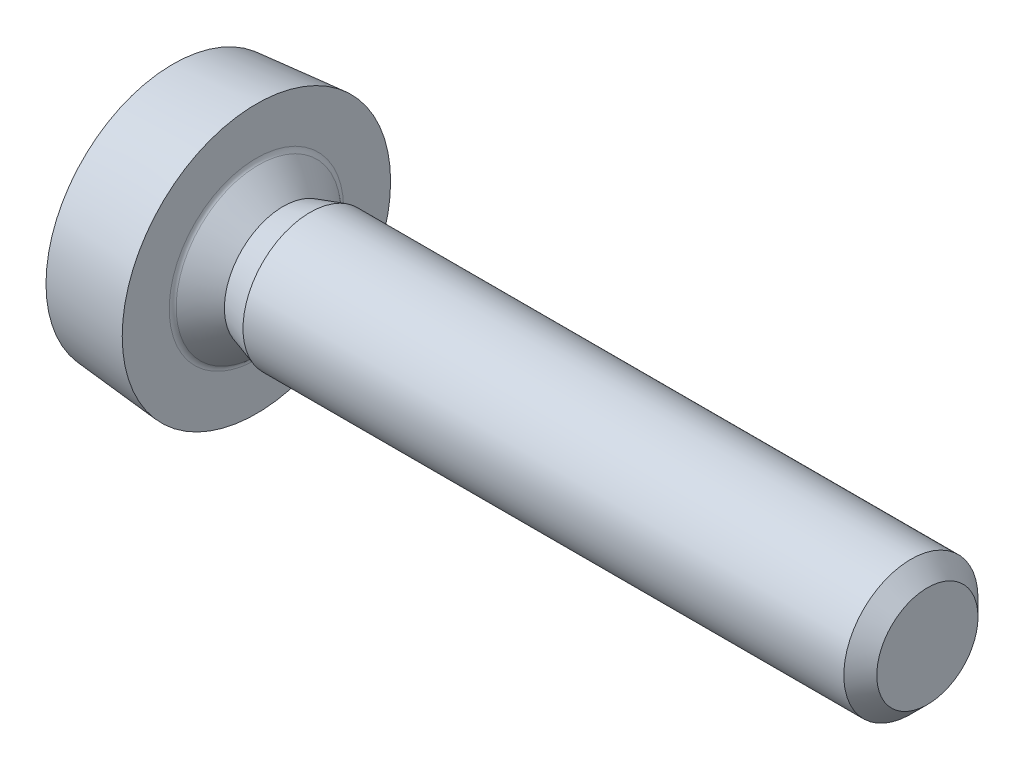
from build123d import *

# Parameters (mm, degrees)
SKETCH2_R               = 1.257053568
BOSS_EXTRUDE1_DEPTH     = 0.4
BOSS_EXTRUDE1_TAPER     = 43.516406292
SKETCH3_R               = 0.87725
BOSS_EXTRUDE2_DEPTH     = 0.4
BOSS_EXTRUDE2_DRAFT     = -17.059940879
SKETCH4_R               = 1
BOSS_EXTRUDE3_DEPTH     = 9.2
CUT_EXTRUDE1_REACH      = 13.222
CUT_EXTRUDE1_END_RADIUS = 4
CHAMFER1_SIZE           = 0.2455
FILLET1_R               = 0.1


with BuildPart() as part:
    # Sketch1 → Revolve1 (revolve)
    with BuildSketch(Plane(origin=(0, 0, 0), x_dir=(-1, 0, 0), z_dir=(0, 0, -1)), mode=Mode.PRIVATE) as revolve1_sk:
        with BuildLine():
            Line((0, 2), (0, 0))
            Line((0, 0), (1.72, 0))
            ThreePointArc((1.72, 0), (1.599364053, 0.974953612), (1.244732728, 1.891099997))
            Line((1.244732728, 1.891099997), (0, 2))
        make_face()
    revolve(revolve1_sk.sketch.rotate(Axis((0, 0, 0), (-1, 0, 0)), 270), axis=Axis((0, 0, 0), (-1, 0, 0)))

    # Sketch2 → Boss-Extrude1 (add)
    with BuildSketch(Plane(origin=(0, 0, 0), x_dir=(0, 0, -1), z_dir=(1, 0, 0))):
        Circle(SKETCH2_R)
    extrude(amount=BOSS_EXTRUDE1_DEPTH, taper=BOSS_EXTRUDE1_TAPER)


with BuildPart() as boss_extrude2_tool:
    # Sketch3 → Boss-Extrude2 (with draft: the straight prism first)
    with BuildSketch(Plane(origin=(0.4, 0, 0), x_dir=(0, 0, -1), z_dir=(1, 0, 0))):
        Circle(SKETCH3_R)
    extrude(amount=BOSS_EXTRUDE2_DEPTH)
    # Boss-Extrude2: the draft: its side faces are tilted about the plane it starts from
    boss_extrude2_sides = [boss_extrude2_tool.faces().sort_by_distance(p)[0] for p in [
        (0.6, 0, 0.87725),
    ]]
    draft(boss_extrude2_sides, Plane(origin=(0.4, 0, 0), x_dir=(0, 0, -1), z_dir=(1, 0, 0)), BOSS_EXTRUDE2_DRAFT)


with BuildPart() as part_1:
    add(part.part)

    # Boss-Extrude2: add boss_extrude2_tool
    add(boss_extrude2_tool.part)

    # Sketch4 → Boss-Extrude3 (add)
    with BuildSketch(Plane(origin=(0.8, 0, 0), x_dir=(0, 0, -1), z_dir=(1, 0, 0))):
        Circle(SKETCH4_R)
    extrude(amount=BOSS_EXTRUDE3_DEPTH)

    # Cut-Extrude1: up to this sphere (the profile starts inside it)
    cut_extrude1_end = Location((2.28, 0, 0)) * Sphere(CUT_EXTRUDE1_END_RADIUS, mode=Mode.PRIVATE)
    # Sketch5 → Cut-Extrude1 (cut, up to the surface)
    with BuildSketch(Plane(origin=(-0.86, 0, 0), x_dir=(0, 0, -1), z_dir=(1, 0, 0)), mode=Mode.PRIVATE) as cut_extrude1_sk1:
        Polygon((0.3125, 0.3125), (0.3125, 1.25), (-0.3125, 1.25), (-0.3125, 0.3125), (-1.25, 0.3125), (-1.25, -0.3125), (-0.3125, -0.3125), (-0.3125, -1.25), (0.3125, -1.25), (0.3125, -0.3125), (1.25, -0.3125), (1.25, 0.3125), align=None)
    cut_extrude1_tool1 = extrude(cut_extrude1_sk1.sketch, amount=-CUT_EXTRUDE1_REACH, mode=Mode.PRIVATE) & cut_extrude1_end
    add(cut_extrude1_tool1.solids().sort_by_distance((-0.86, 0, 0))[0], mode=Mode.SUBTRACT)

    # Chamfer1
    chamfer1_edges = [part_1.edges().sort_by_distance(p)[0] for p in [
        (10, 0, 1),
    ]]
    chamfer(chamfer1_edges, length=CHAMFER1_SIZE)

    # Fillet1
    fillet1_edges = [part_1.edges().sort_by_distance(p)[0] for p in [
        (0, 0, 1.257053568),
    ]]
    fillet(fillet1_edges, radius=FILLET1_R)


solid = part_1.part
